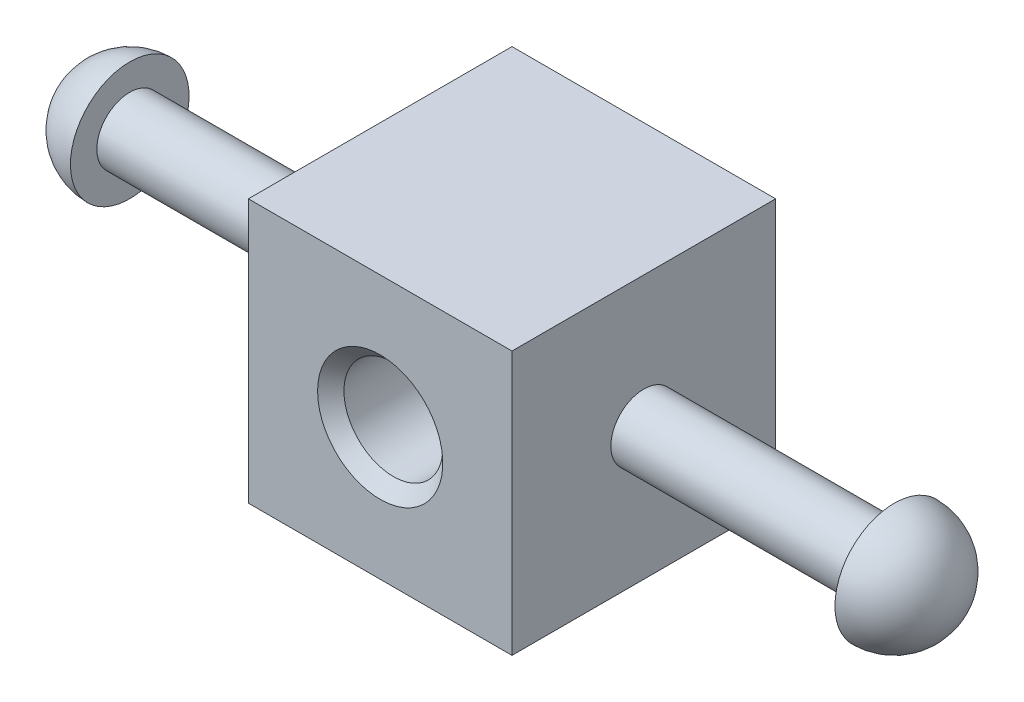
from build123d import *

# Parameters (mm, degrees)
SKETCH1_W           = 25.4
SKETCH1_H           = 25.4
SKETCH1_R           = 4.7625
BOSS_EXTRUDE1_DEPTH = 25.4
CHAMFER1_SIZE       = 1.27
SKETCH3_W           = 24.13
SKETCH3_H           = 3.175
SKETCH4_W           = 24.13
SKETCH4_H           = 3.175


with BuildPart() as part:
    # Sketch1 → Boss-Extrude1 (new body)
    with BuildSketch(Plane.XY):
        with Locations((12.7, 12.7)):
            Rectangle(SKETCH1_W, SKETCH1_H)
        with Locations((12.7, 12.7)):
            Circle(SKETCH1_R, mode=Mode.SUBTRACT)
    extrude(amount=BOSS_EXTRUDE1_DEPTH)

    # Chamfer1
    chamfer1_edges = [part.edges().sort_by_distance(p)[0] for p in [
        (7.9375, 12.7, 0),
        (7.9375, 12.7, 25.4),
    ]]
    chamfer(chamfer1_edges, length=CHAMFER1_SIZE)

    # Sketch3 → Revolve5 (revolve)
    with BuildSketch(Plane.XY.offset(12.7)):
        with Locations((-12.065, 14.2875)):
            Rectangle(SKETCH3_W, SKETCH3_H)
        with BuildLine():
            Line((-29.845, 12.7), (-24.13, 12.7))
            Line((-24.13, 12.7), (-24.13, 15.875))
            Line((-24.13, 15.875), (-24.13, 18.415))
            ThreePointArc((-24.13, 18.415), (-28.171115254, 16.741115254), (-29.845, 12.7))
        make_face()
    revolve(axis=Axis((0, 12.7, 12.7), (-1, 0, 0)))

    # Sketch4 → Revolve6 (revolve)
    with BuildSketch(Plane.XY.offset(12.7), mode=Mode.PRIVATE) as revolve6_sk:
        with BuildLine():
            Line((49.53, 15.875), (49.53, 12.7))
            Line((49.53, 12.7), (55.245, 12.7))
            ThreePointArc((55.245, 12.7), (53.571115254, 16.741115254), (49.53, 18.415))
            Line((49.53, 18.415), (49.53, 15.875))
        make_face()
        with Locations((37.465, 14.2875)):
            Rectangle(SKETCH4_W, SKETCH4_H)
    revolve(revolve6_sk.sketch.rotate(Axis((25.4, 12.7, 12.7), (1, 0, 0)), 180), axis=Axis((25.4, 12.7, 12.7), (1, 0, 0)))


solid = part.part
